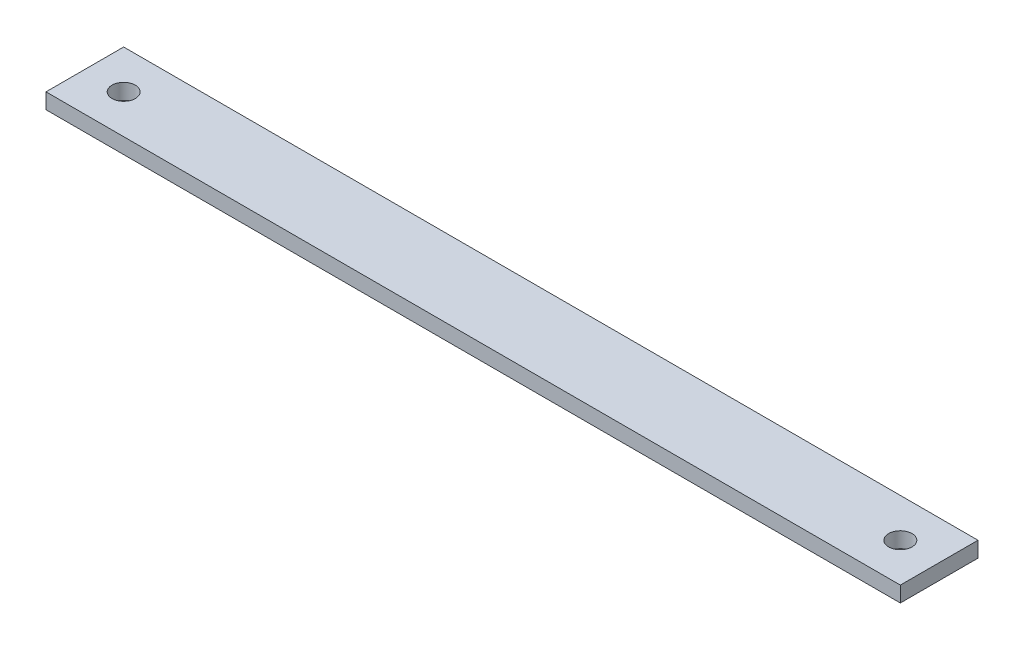
from build123d import *

# Parameters (mm, degrees)
SKETCH3_W           = 110
SKETCH3_H           = 10
SKETCH3_R           = 1.5
BOSS_EXTRUDE1_DEPTH = 2


with BuildPart() as part:
    # Sketch3 → Boss-Extrude1 (new body)
    with BuildSketch(Plane(origin=(0, 0, 0), x_dir=(1, 0, 0), z_dir=(0, 1, 0))):
        Rectangle(SKETCH3_W, SKETCH3_H)
        with Locations(Location((-50, 0, 0), (0, 0, 270))):
            Circle(SKETCH3_R, mode=Mode.SUBTRACT)
        with Locations(Location((50, 0, 0), (0, 0, 90))):
            Circle(SKETCH3_R, mode=Mode.SUBTRACT)
    extrude(amount=BOSS_EXTRUDE1_DEPTH)


solid = part.part
